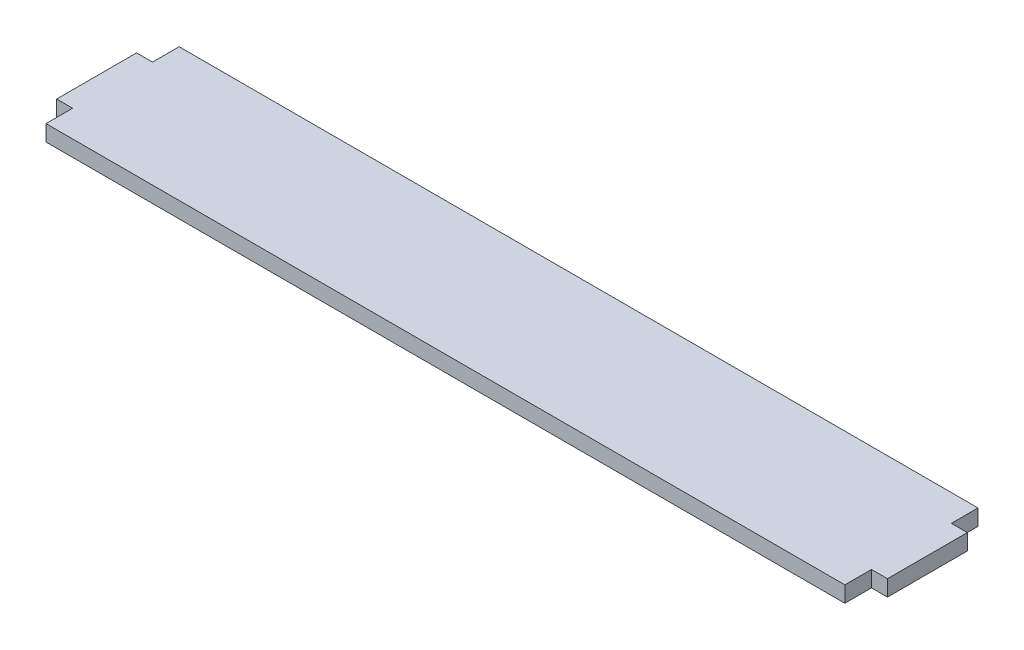
from build123d import *

# Parameters (mm, degrees)
SALIENTE_EXTRUIR1_DEPTH = 3


with BuildPart() as part:
    # Croquis1 → Saliente-Extruir1 (new body)
    with BuildSketch(Plane(origin=(0, 0, 0), x_dir=(1, 0, 0), z_dir=(0, 1, 0))):
        Polygon((0, 5), (0, 0), (150, 0), (150, 5), (153, 5), (153, 20), (150, 20), (150, 25), (0, 25), (0, 20), (-3, 20), (-3, 5), align=None)
    extrude(amount=SALIENTE_EXTRUIR1_DEPTH)


solid = part.part
